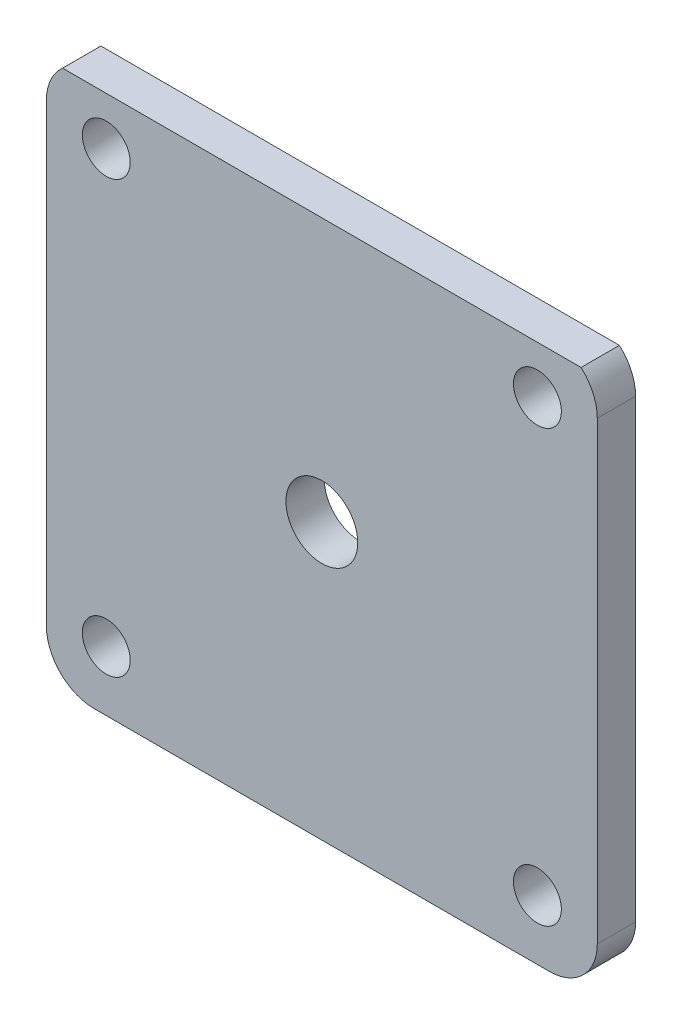
from build123d import *

# Parameters (mm, degrees)
SKETCH1_R           = 1.5
SKETCH1_R_2         = 1
BOSS_EXTRUDE1_DEPTH = 1.6
SKETCH3_W           = 30.784918317
SKETCH3_H           = 1.24969352
CUT_EXTRUDE2_DEPTH  = 10


with BuildPart() as part:
    # Sketch1 → Boss-Extrude1 (new body)
    with BuildSketch(Plane.XY):
        with BuildLine():
            Line((-9.5, -11.5), (9.5, -11.5))
            ThreePointArc((9.5, -11.5), (10.914213562, -10.914213562), (11.5, -9.5))
            Line((11.5, -9.5), (11.5, 9.5))
            ThreePointArc((11.5, 9.5), (10.914213562, 10.914213562), (9.5, 11.5))
            Line((9.5, 11.5), (-9.5, 11.5))
            ThreePointArc((-9.5, 11.5), (-10.914213562, 10.914213562), (-11.5, 9.5))
            Line((-11.5, 9.5), (-11.5, -9.5))
            ThreePointArc((-11.5, -9.5), (-10.914213562, -10.914213562), (-9.5, -11.5))
        make_face()
        Circle(SKETCH1_R, mode=Mode.SUBTRACT)
        with Locations((9, 9)):
            Circle(SKETCH1_R_2, mode=Mode.SUBTRACT)
        with Locations(Location((-9, 9, 0), (0, 0, 180))):
            Circle(SKETCH1_R_2, mode=Mode.SUBTRACT)
        with Locations((-9, -9)):
            Circle(SKETCH1_R_2, mode=Mode.SUBTRACT)
        with Locations(Location((9, -9, 0), (0, 0, 180))):
            Circle(SKETCH1_R_2, mode=Mode.SUBTRACT)
    extrude(amount=BOSS_EXTRUDE1_DEPTH)

    # Sketch3 → Cut-Extrude2 (cut)
    with BuildSketch(Plane(origin=(0, 0, 0), x_dir=(-1, 0, 0), z_dir=(0, 0, -1))):
        with Locations((-2.857529043, 11.62484676)):
            Rectangle(SKETCH3_W, SKETCH3_H)
    extrude(amount=-CUT_EXTRUDE2_DEPTH, mode=Mode.SUBTRACT)


solid = part.part
